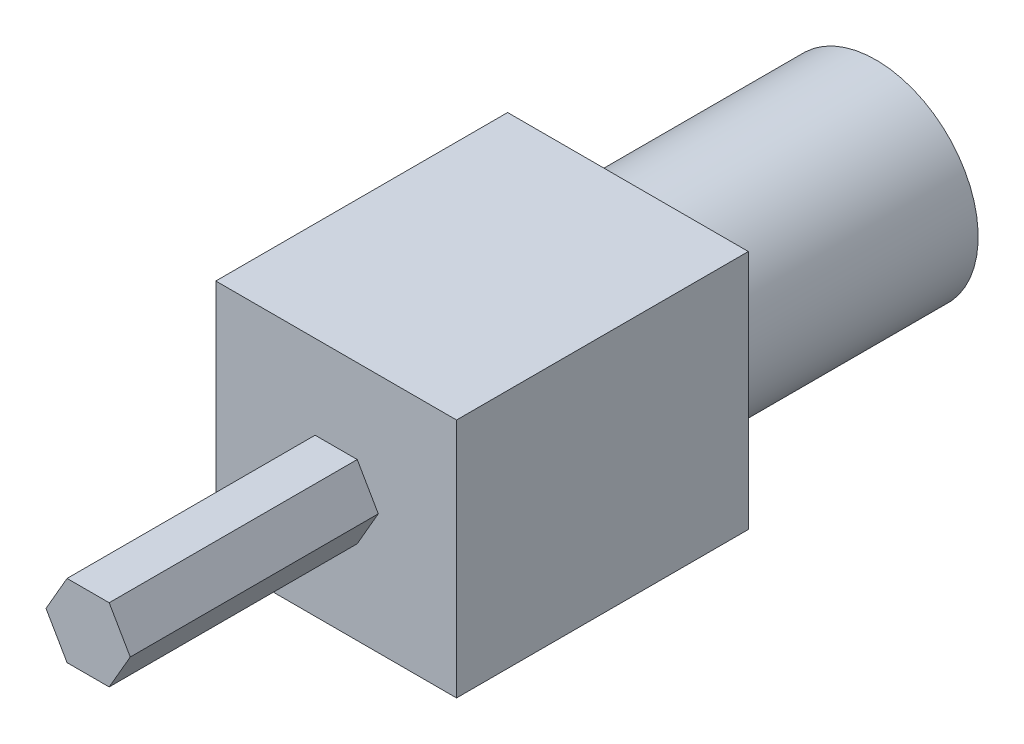
from build123d import *

# Parameters (mm, degrees)
SKETCH1_W           = 41.91
SKETCH1_H           = 50.8
BOSS_EXTRUDE1_DEPTH = 41.91
SKETCH2_R           = 17.78
BOSS_EXTRUDE2_DEPTH = 43.18
BOSS_EXTRUDE4_DEPTH = 43.18


with BuildPart() as part:
    # Sketch1 → Boss-Extrude1 (new body)
    with BuildSketch(Plane(origin=(0, 0, 0), x_dir=(1, 0, 0), z_dir=(0, 1, 0))):
        with Locations((-20.955, 25.4)):
            Rectangle(SKETCH1_W, SKETCH1_H)
    extrude(amount=BOSS_EXTRUDE1_DEPTH)

    # Sketch2 → Boss-Extrude2 (add)
    with BuildSketch(Plane(origin=(0, 0, -50.8), x_dir=(-1, 0, 0), z_dir=(0, 0, -1))):
        with Locations((20.955, 20.955)):
            Circle(SKETCH2_R)
    extrude(amount=BOSS_EXTRUDE2_DEPTH)

    # Sketch3 → Boss-Extrude4 (add)
    with BuildSketch(Plane.XY):
        Polygon((-13.622651581, 20.955), (-17.288825791, 27.305), (-24.621174209, 27.305), (-28.287348419, 20.955), (-24.621174209, 14.605), (-17.288825791, 14.605), align=None)
    extrude(amount=BOSS_EXTRUDE4_DEPTH)


solid = part.part
